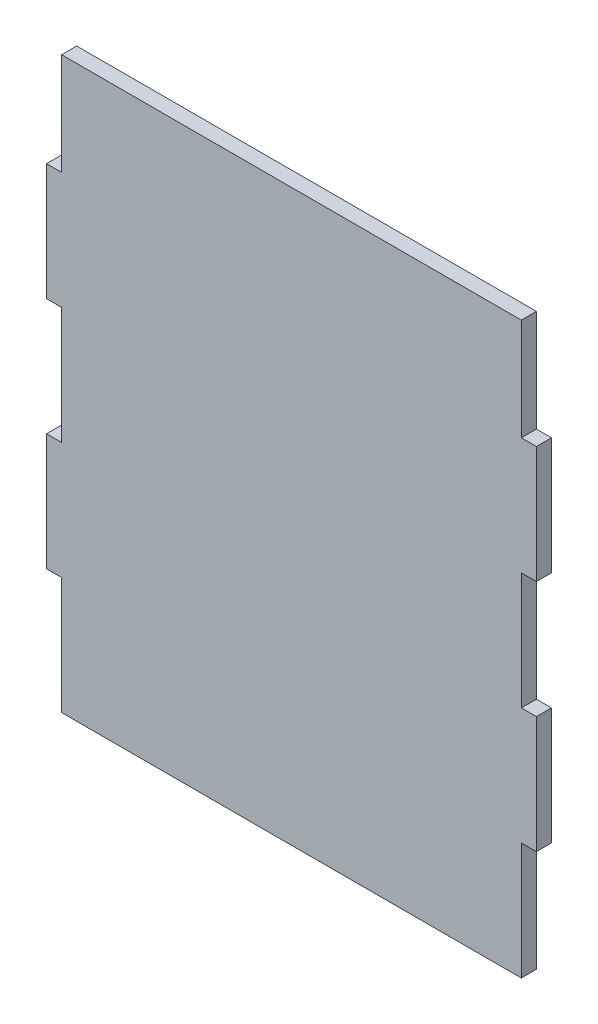
from build123d import *

# Parameters (mm, degrees)
BOSS_EXTRUDE1_DEPTH = 3.175


with BuildPart() as part:
    # Sketch1 → Boss-Extrude1 (new body)
    with BuildSketch(Plane.XY):
        Polygon((-81.825, 0), (15, 0), (15, 24.635), (18.175, 24.635), (18.175, 49.27), (15, 49.27), (15, 73.905), (18.175, 73.905), (18.175, 98.54), (15, 98.54), (15, 120), (-81.825, 120), (-81.825, 98.54), (-85, 98.54), (-85, 73.905), (-81.825, 73.905), (-81.825, 49.27), (-85, 49.27), (-85, 24.635), (-81.825, 24.635), align=None)
    extrude(amount=BOSS_EXTRUDE1_DEPTH)


solid = part.part
